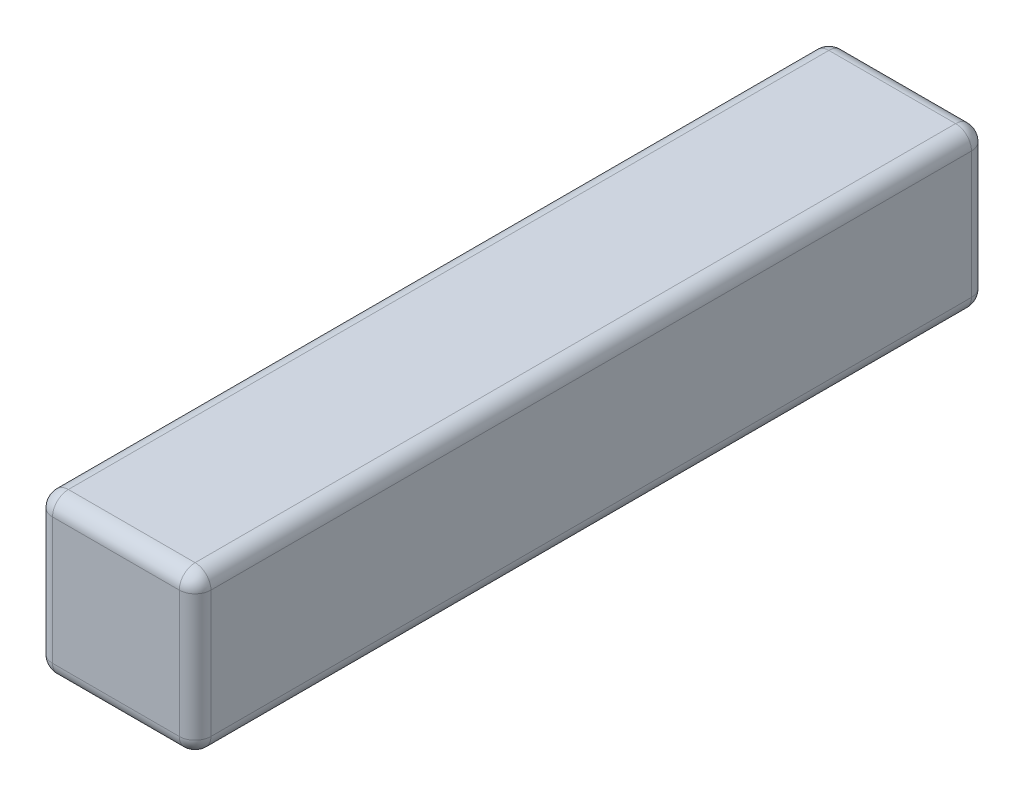
from build123d import *

# Parameters (mm, degrees)
BOSS_EXTRUDE1_DEPTH      = 5
BOSS_EXTRUDE1_DEPTH_BACK = 5
SKETCH1_W                = 2
SKETCH1_H                = 2
FILLET1_R                = 0.2


with BuildPart() as part:
    # Sketch1 → Boss-Extrude1 (new, two sides: drawn at the far end of the back side and taken through both)
    with BuildSketch(Plane.XY.offset(-BOSS_EXTRUDE1_DEPTH_BACK)):
        Rectangle(SKETCH1_W, SKETCH1_H)
    extrude(amount=BOSS_EXTRUDE1_DEPTH + BOSS_EXTRUDE1_DEPTH_BACK)

    # Fillet1
    fillet1_edges = [part.edges().sort_by_distance(p)[0] for p in [
        (0, -1, -5),
        (-1, 0, -5),
        (-1, -1, 0),
        (1, 0, -5),
        (0, 1, -5),
        (0, -1, 5),
        (-1, 0, 5),
        (-1, 1, 0),
        (1, -1, 0),
        (1, 1, 0),
        (1, 0, 5),
        (0, 1, 5),
    ]]
    fillet(fillet1_edges, radius=FILLET1_R)


solid = part.part
